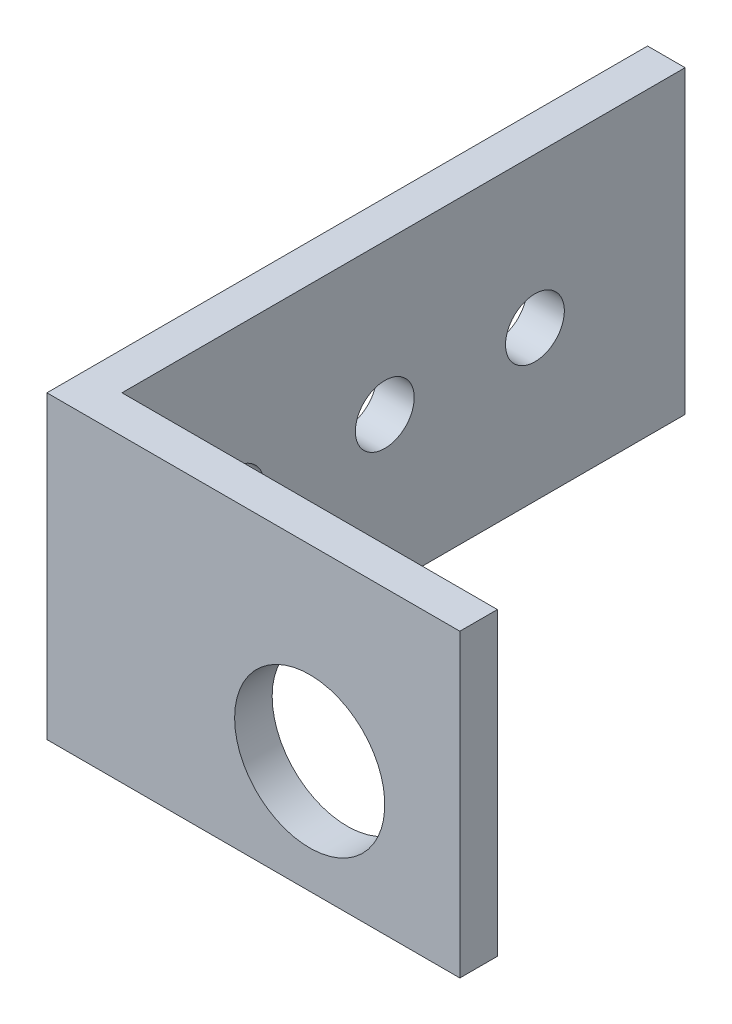
from build123d import *

# Parameters (mm, degrees)
BOSS_EXTRUDE1_DEPTH = 25.4
SKETCH3_R           = 6.35
CUT_EXTRUDE1_DEPTH  = 65.288850122
SKETCH4_R           = 2.4892
CUT_EXTRUDE2_DEPTH  = 66.068137364


with BuildPart() as part:
    # Sketch2 → Boss-Extrude1 (new body)
    with BuildSketch(Plane(origin=(0, 0, 0), x_dir=(1, 0, 0), z_dir=(0, 1, 0))):
        Polygon((0, 0), (0, 50.8), (3.175, 50.8), (3.175, 3.175), (34.925, 3.175), (34.925, 0), align=None)
    extrude(amount=BOSS_EXTRUDE1_DEPTH)

    # Sketch3 → Cut-Extrude1 (cut, through all)
    with BuildSketch(Plane(origin=(0, 0, -3.175), x_dir=(-1, 0, 0), z_dir=(0, 0, -1))):
        with Locations((-22.225, 9.525)):
            Circle(SKETCH3_R)
    extrude(amount=-CUT_EXTRUDE1_DEPTH, mode=Mode.SUBTRACT)

    # Sketch4 → Cut-Extrude2 (cut, through all)
    with BuildSketch(Plane(origin=(3.175, 0, 0), x_dir=(0, 0, -1), z_dir=(1, 0, 0))):
        with Locations((25.4, 12.7)):
            Circle(SKETCH4_R)
        with Locations((12.7, 12.7)):
            Circle(SKETCH4_R)
        with Locations((38.1, 12.7)):
            Circle(SKETCH4_R)
    extrude(amount=-CUT_EXTRUDE2_DEPTH, mode=Mode.SUBTRACT)


solid = part.part
